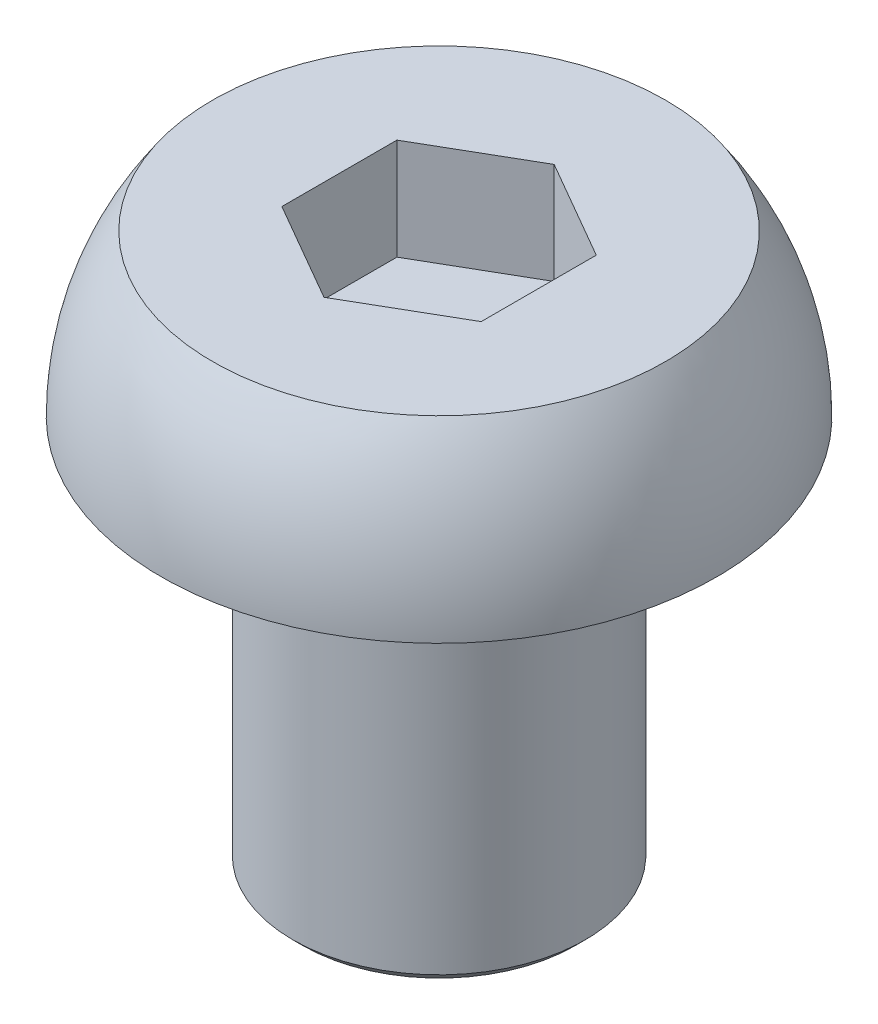
from build123d import *

# Parameters (mm, degrees)
SKETCH_2_R            = 1.5
EXTRUDE_460_DEPTH     = 4
CUT_EXTRUDE_626_DEPTH = 1.04
CHAMFER_688_SIZE      = 0.1


with BuildPart() as part:
    # 草图1 → Revolve 370 (revolve)
    with BuildSketch(Plane.XY, mode=Mode.PRIVATE) as revolve_370_sk:
        with BuildLine():
            Line((0, 0), (2.85, 0))
            ThreePointArc((2.85, 0), (2.715262558, 0.865938358), (2.323790008, 1.65))
            Line((2.323790008, 1.65), (0, 1.65))
            Line((0, 1.65), (0, 0))
        make_face()
    revolve(revolve_370_sk.sketch.rotate(Axis((0, 0, 0), (0, 1, 0)), 90), axis=Axis((0, 0, 0), (0, 1, 0)))

    # 草图2 → Extrude 460 (add)
    with BuildSketch(Plane.XZ):
        with Locations(Location((0, 0, 0), (0, 0, 270))):
            Circle(SKETCH_2_R)
    extrude(amount=EXTRUDE_460_DEPTH)

    # 草图3 → Cut-Extrude 626 (cut)
    with BuildSketch(Plane(origin=(0, 1.65, 0), x_dir=(1, 0, 0), z_dir=(0, 1, 0))):
        Polygon((1.0225, -0.59034065), (1.0225, 0.59034065), (0, 1.1806813), (-1.0225, 0.59034065), (-1.0225, -0.59034065), (0, -1.1806813), align=None)
    extrude(amount=-CUT_EXTRUDE_626_DEPTH, mode=Mode.SUBTRACT)

    # Chamfer 688
    chamfer_688_edges = [part.edges().sort_by_distance(p)[0] for p in [
        (0, -4, 1.5),
    ]]
    chamfer(chamfer_688_edges, length=CHAMFER_688_SIZE)


solid = part.part
